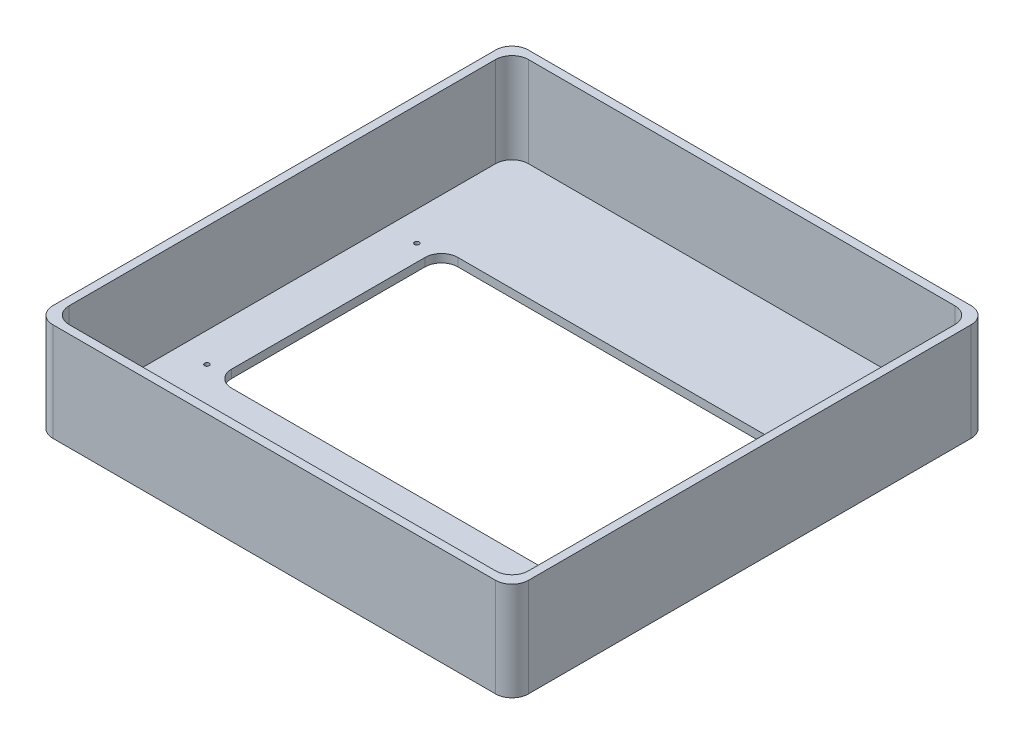
from build123d import *

# Parameters (mm, degrees)
SKETCH_1_W          = 290
SKETCH_1_H          = 290
EXTRUDE_1_DEPTH     = 60
SKETCH_2_W          = 280
SKETCH_2_H          = 280
CUT_EXTRUDE_2_DEPTH = 55
SKETCH_3_W          = 224
SKETCH_3_H          = 138
CUT_EXTRUDE_3_DEPTH = 5
SKETCH_4_R          = 1.4
CUT_EXTRUDE_4_DEPTH = 5
FILLET_1_R          = 10
FILLET_2_R          = 10


with BuildPart() as part:
    # 草图1 → 凸台-拉伸1 (new body)
    with BuildSketch(Plane(origin=(0, 0, 0), x_dir=(1, 0, 0), z_dir=(0, 1, 0))):
        Rectangle(SKETCH_1_W, SKETCH_1_H)
    extrude(amount=EXTRUDE_1_DEPTH)

    # 草图2 → 切除-拉伸2 (cut)
    with BuildSketch(Plane(origin=(0, 60, 0), x_dir=(1, 0, 0), z_dir=(0, 1, 0))):
        Rectangle(SKETCH_2_W, SKETCH_2_H)
    extrude(amount=-CUT_EXTRUDE_2_DEPTH, mode=Mode.SUBTRACT)

    # 草图3 → 切除-拉伸3 (cut)
    with BuildSketch(Plane(origin=(0, 5, 0), x_dir=(1, 0, 0), z_dir=(0, 1, 0))):
        Rectangle(SKETCH_3_W, SKETCH_3_H)
    extrude(amount=-CUT_EXTRUDE_3_DEPTH, mode=Mode.SUBTRACT)

    # 草图4 → 切除-拉伸4 (cut)
    with BuildSketch(Plane.XZ):
        with Locations(Location((-122, 64, 0), (0, 0, 270))):
            Circle(SKETCH_4_R)
        with Locations(Location((122, 64, 0), (0, 0, 270))):
            Circle(SKETCH_4_R)
        with Locations(Location((122, -64, 0), (0, 0, 270))):
            Circle(SKETCH_4_R)
        with Locations(Location((-122, -64, 0), (0, 0, 270))):
            Circle(SKETCH_4_R)
    extrude(amount=-CUT_EXTRUDE_4_DEPTH, mode=Mode.SUBTRACT)

    # 圆角1
    fillet_1_edges = [part.edges().sort_by_distance(p)[0] for p in [
        (140, 32.5, -140),
        (-140, 32.5, -140),
        (-140, 32.5, 140),
        (140, 32.5, 140),
        (145, 30, 145),
        (-145, 30, 145),
        (-145, 30, -145),
        (145, 30, -145),
    ]]
    fillet(fillet_1_edges, radius=FILLET_1_R)

    # 圆角2
    fillet_2_edges = [part.edges().sort_by_distance(p)[0] for p in [
        (-112, 2.5, -69),
        (-112, 2.5, 69),
        (112, 2.5, 69),
        (112, 2.5, -69),
    ]]
    fillet(fillet_2_edges, radius=FILLET_2_R)


solid = part.part
